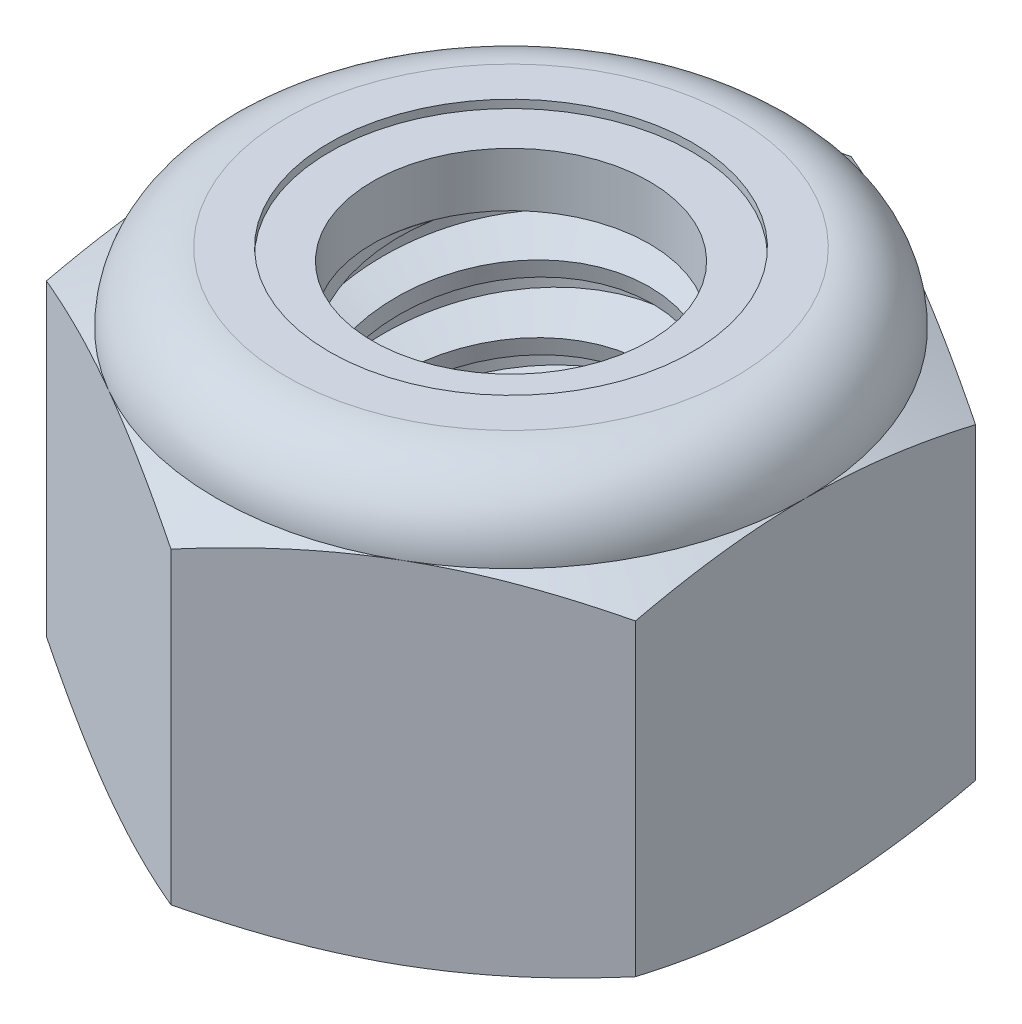
from build123d import *

# Parameters (mm, degrees)
EXTRUDE1_DEPTH      = 7.9375
SKETCH2_W           = 3.175
SKETCH2_H           = 7.9375
LPATTERN1_COUNT     = 6
LPATTERN1_PITCH     = 1.27
LPATTERN1_COL_COUNT = 2
LPATTERN1_COL_PITCH = 1.27


with BuildPart() as part:
    # Sketch1 → Extrude1 (new body)
    with BuildSketch(Plane(origin=(0, 0, 0), x_dir=(1, 0, 0), z_dir=(0, 1, 0))):
        Polygon((0, 6.415804866), (-5.55625, 3.207902433), (-5.55625, -3.207902433), (0, -6.415804866), (5.55625, -3.207902433), (5.55625, 3.207902433), align=None)
    extrude(amount=EXTRUDE1_DEPTH)

    # Sketch4 → Cut-Revolve2 (revolve, cut)
    with BuildSketch(Plane(origin=(0, 0, 0), x_dir=(0, 0, -1), z_dir=(1, 0, 0)), mode=Mode.PRIVATE) as cut_revolve2_sk:
        Polygon((0, 7.9375), (3.175, 7.9375), (2.609908356, 7.673993439), (2.609908356, 0.263506561), (3.175, 0), (0, 0), align=None)
    revolve(cut_revolve2_sk.sketch.rotate(Axis((0, 7.9375, 0), (0, 1, 0)), 54.49881281), axis=Axis((0, 7.9375, 0), (0, 1, 0)), mode=Mode.SUBTRACT)


with BuildPart() as body_2:
    # Sketch2 → Revolve1 (revolve)
    with BuildSketch(Plane(origin=(0, 0, 0), x_dir=(0, 0, -1), z_dir=(1, 0, 0))):
        with Locations((1.5875, 3.96875)):
            Rectangle(SKETCH2_W, SKETCH2_H)
    revolve(axis=Axis((0, -3.175, 0), (0, 1, 0)))

    # Sketch3 → Cut-Revolve1 (revolve, cut)
    with BuildSketch(Plane(origin=(0, 0, 0), x_dir=(0, 0, -1), z_dir=(1, 0, 0)), mode=Mode.PRIVATE) as cut_revolve1_sk:
        Polygon((3.206133436, 7.781832818), (3.424067492, 6.692162542), (2.672175229, 6.946518763), (2.609908356, 7.257853128), align=None)
    cut_revolve1 = revolve(cut_revolve1_sk.sketch.rotate(Axis((0, 7.9375, 0.272704483), (0, -0.9805806756909201, -0.19611613513818418)), 180), axis=Axis((0, 7.9375, 0.272704483), (0, -0.9805806756909201, -0.19611613513818418)), mode=Mode.SUBTRACT)

    # LPattern1: Cut-Revolve1 ×6
    with Locations(*[(0, -i * LPATTERN1_PITCH, 0) for i in range(1, LPATTERN1_COUNT)]):
        add(cut_revolve1, mode=Mode.SUBTRACT)

    # LPattern1 col: Cut-Revolve1 ×2
    with Locations(*[(0, i * LPATTERN1_COL_PITCH, 0) for i in range(1, LPATTERN1_COL_COUNT)]):
        add(cut_revolve1, mode=Mode.SUBTRACT)


with BuildPart() as part_1:
    add(part.part)

    # Combine1: cut body 2
    add(body_2.part, mode=Mode.SUBTRACT)

    # Sketch5 → Cut-Revolve3 (revolve, cut)
    with BuildSketch(Plane(origin=(0, 0, 0), x_dir=(0, 0, -1), z_dir=(1, 0, 0)), mode=Mode.PRIVATE) as cut_revolve3_sk:
        with BuildLine():
            Line((0, 0), (5.55625, 0))
            Line((5.55625, 0), (6.415804866, 0.400817017))
            Line((6.415804866, 0.400817017), (6.415804866, 6.213766317))
            Line((6.415804866, 6.213766317), (5.55625, 6.614583333))
            ThreePointArc((5.55625, 6.614583333), (5.168776679, 7.550026679), (4.233333333, 7.9375))
            Line((4.233333333, 7.9375), (4.233333333, 9.2075))
            Line((4.233333333, 9.2075), (7.685804866, 9.2075))
            Line((7.685804866, 9.2075), (7.685804866, -1.27))
            Line((7.685804866, -1.27), (0, -1.27))
            Line((0, -1.27), (0, 0))
        make_face()
    revolve(cut_revolve3_sk.sketch.rotate(Axis((0, 0, 0), (0, 1, 0)), 54.619043446), axis=Axis((0, 0, 0), (0, 1, 0)), mode=Mode.SUBTRACT)

    # Sketch6 → Cut-Revolve4 (revolve, cut)
    with BuildSketch(Plane(origin=(0, 0, 0), x_dir=(0, 0, -1), z_dir=(1, 0, 0)), mode=Mode.PRIVATE) as cut_revolve4_sk:
        with BuildLine():
            Line((0, 6.614583333), (5.40385, 6.614583333))
            ThreePointArc((5.40385, 6.614583333), (5.061013606, 7.442263606), (4.233333333, 7.7851))
            Line((4.233333333, 7.7851), (3.421620845, 7.7851))
            Line((3.421620845, 7.7851), (3.421620845, 9.2075))
            Line((3.421620845, 9.2075), (0, 9.2075))
            Line((0, 9.2075), (0, 6.614583333))
        make_face()
    revolve(cut_revolve4_sk.sketch.rotate(Axis((0, 9.2075, 0), (0, 1, 0)), 54.49881281), axis=Axis((0, 9.2075, 0), (0, 1, 0)), mode=Mode.SUBTRACT)


with BuildPart() as body_2_2:
    # Sketch7 → Revolve2 (revolve)
    with BuildSketch(Plane(origin=(0, 0, 0), x_dir=(0, 0, -1), z_dir=(1, 0, 0))):
        with BuildLine():
            Line((2.609908356, 6.690783333), (5.324993778, 6.690783333))
            ThreePointArc((5.324993778, 6.690783333), (4.979705237, 7.4148695), (4.233333333, 7.7089))
            Line((4.233333333, 7.7089), (2.609908356, 7.7089))
            Line((2.609908356, 7.7089), (2.609908356, 6.690783333))
        make_face()
    revolve(axis=Axis((0, 6.690783333, 0), (0, 1, 0)))


solid = Compound([part_1.part, body_2_2.part])
